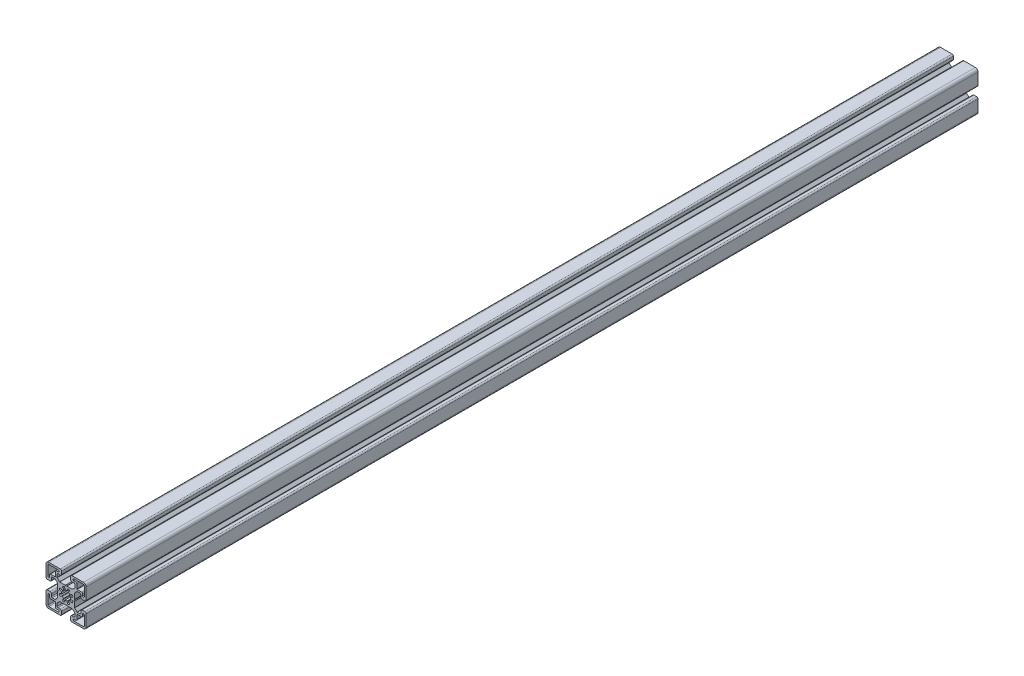
from build123d import *

# Parameters (mm, degrees)
EXTRUDE1_DEPTH = 1000


with BuildPart() as part:
    # Sketch1 → Extrude1 (new body)
    with BuildSketch(Plane.XY):
        with BuildLine():
            Line((2.070696762, -5.483119356), (2.970696689, -4.967971313))
            Line((2.970696689, -4.967971313), (3.870696615, -5.483119356))
            Line((3.870696615, -5.483119356), (10.022269564, -5.483119356))
            ThreePointArc((10.022269564, -5.483119356), (10.167689268, -5.512045134), (10.290970141, -5.59441878))
            Line((10.290970141, -5.59441878), (12.909397265, -8.212845904))
            ThreePointArc((12.909397265, -8.212845904), (12.991770911, -8.336126777), (13.020696689, -8.481546481))
            Line((13.020696689, -8.481546481), (13.020696689, -11.483119356))
            ThreePointArc((13.020696689, -11.483119356), (12.72780347, -12.190226138), (12.020696689, -12.483119356))
            Line((12.020696689, -12.483119356), (9.555696689, -12.483119356))
            ThreePointArc((9.555696689, -12.483119356), (8.480894381, -12.928317049), (8.035696689, -14.003119356))
            Line((8.035696689, -14.003119356), (8.035696689, -16.963119356))
            ThreePointArc((8.035696689, -16.963119356), (8.480894381, -18.037921664), (9.555696689, -18.483119356))
            Line((9.555696689, -18.483119356), (22.470696689, -18.483119356))
            ThreePointArc((22.470696689, -18.483119356), (24.592017032, -17.6044397), (25.470696689, -15.483119356))
            Line((25.470696689, -15.483119356), (25.470696689, -2.568119356))
            ThreePointArc((25.470696689, -2.568119356), (25.025498996, -1.493317049), (23.950696689, -1.048119356))
            Line((23.950696689, -1.048119356), (20.990696689, -1.048119356))
            ThreePointArc((20.990696689, -1.048119356), (19.915894381, -1.493317049), (19.470696689, -2.568119356))
            Line((19.470696689, -2.568119356), (19.470696689, -5.033119356))
            ThreePointArc((19.470696689, -5.033119356), (19.17780347, -5.740226138), (18.470696689, -6.033119356))
            Line((18.470696689, -6.033119356), (15.469123813, -6.033119356))
            ThreePointArc((15.469123813, -6.033119356), (15.323704109, -6.004193579), (15.200423236, -5.921819933))
            Line((15.200423236, -5.921819933), (12.581996112, -3.303392809))
            ThreePointArc((12.581996112, -3.303392809), (12.499622466, -3.180111936), (12.470696689, -3.034692232))
            Line((12.470696689, -3.034692232), (12.470696689, 3.116881008))
            Line((12.470696689, 3.116881008), (11.951083419, 4.016880644))
            Line((11.951083419, 4.016880644), (12.470696689, 4.916880279))
            Line((12.470696689, 4.916880279), (12.470696689, 11.068453519))
            ThreePointArc((12.470696689, 11.068453519), (12.499622466, 11.213873223), (12.581996112, 11.337154096))
            Line((12.581996112, 11.337154096), (15.200423236, 13.95558122))
            ThreePointArc((15.200423236, 13.95558122), (15.323704109, 14.037954866), (15.469123813, 14.066880644))
            Line((15.469123813, 14.066880644), (18.470696689, 14.066880644))
            ThreePointArc((18.470696689, 14.066880644), (19.17780347, 13.773987425), (19.470696689, 13.066880644))
            Line((19.470696689, 13.066880644), (19.470696689, 10.601880644))
            ThreePointArc((19.470696689, 10.601880644), (19.915894381, 9.527078336), (20.990696689, 9.081880644))
            Line((20.990696689, 9.081880644), (23.950696689, 9.081880644))
            ThreePointArc((23.950696689, 9.081880644), (25.025498996, 9.527078336), (25.470696689, 10.601880644))
            Line((25.470696689, 10.601880644), (25.470696689, 23.516880644))
            ThreePointArc((25.470696689, 23.516880644), (24.592017032, 25.638200987), (22.470696689, 26.516880644))
            Line((22.470696689, 26.516880644), (9.555696689, 26.516880644))
            ThreePointArc((9.555696689, 26.516880644), (8.480894381, 26.071682951), (8.035696689, 24.996880644))
            Line((8.035696689, 24.996880644), (8.035696689, 22.036880644))
            ThreePointArc((8.035696689, 22.036880644), (8.480894381, 20.962078336), (9.555696689, 20.516880644))
            Line((9.555696689, 20.516880644), (12.020696689, 20.516880644))
            ThreePointArc((12.020696689, 20.516880644), (12.72780347, 20.223987425), (13.020696689, 19.516880644))
            Line((13.020696689, 19.516880644), (13.020696689, 16.515307768))
            ThreePointArc((13.020696689, 16.515307768), (12.991770911, 16.369888064), (12.909397265, 16.246607191))
            Line((12.909397265, 16.246607191), (10.290970141, 13.628180067))
            ThreePointArc((10.290970141, 13.628180067), (10.167689268, 13.545806421), (10.022269564, 13.516880644))
            Line((10.022269564, 13.516880644), (3.870696615, 13.516880644))
            Line((3.870696615, 13.516880644), (2.970696689, 13.0017326))
            Line((2.970696689, 13.0017326), (2.070696762, 13.516880644))
            Line((2.070696762, 13.516880644), (-4.080876187, 13.516880644))
            ThreePointArc((-4.080876187, 13.516880644), (-4.226295891, 13.545806421), (-4.349576764, 13.628180067))
            Line((-4.349576764, 13.628180067), (-6.968003888, 16.246607191))
            ThreePointArc((-6.968003888, 16.246607191), (-7.050377534, 16.369888064), (-7.079303311, 16.515307768))
            Line((-7.079303311, 16.515307768), (-7.079303311, 19.516880644))
            ThreePointArc((-7.079303311, 19.516880644), (-6.786410093, 20.223987425), (-6.079303311, 20.516880644))
            Line((-6.079303311, 20.516880644), (-3.614303311, 20.516880644))
            ThreePointArc((-3.614303311, 20.516880644), (-2.539501004, 20.962078336), (-2.094303311, 22.036880644))
            Line((-2.094303311, 22.036880644), (-2.094303311, 24.996880644))
            ThreePointArc((-2.094303311, 24.996880644), (-2.539501004, 26.071682951), (-3.614303311, 26.516880644))
            Line((-3.614303311, 26.516880644), (-16.529303311, 26.516880644))
            ThreePointArc((-16.529303311, 26.516880644), (-18.650623655, 25.638200987), (-19.529303311, 23.516880644))
            Line((-19.529303311, 23.516880644), (-19.529303311, 10.601880644))
            ThreePointArc((-19.529303311, 10.601880644), (-19.084105619, 9.527078336), (-18.009303311, 9.081880644))
            Line((-18.009303311, 9.081880644), (-15.049303311, 9.081880644))
            ThreePointArc((-15.049303311, 9.081880644), (-13.974501004, 9.527078336), (-13.529303311, 10.601880644))
            Line((-13.529303311, 10.601880644), (-13.529303311, 13.066880644))
            ThreePointArc((-13.529303311, 13.066880644), (-13.236410093, 13.773987425), (-12.529303311, 14.066880644))
            Line((-12.529303311, 14.066880644), (-9.527730436, 14.066880644))
            ThreePointArc((-9.527730436, 14.066880644), (-9.382310732, 14.037954866), (-9.259029859, 13.95558122))
            Line((-9.259029859, 13.95558122), (-6.640602735, 11.337154096))
            ThreePointArc((-6.640602735, 11.337154096), (-6.558229089, 11.213873223), (-6.529303311, 11.068453519))
            Line((-6.529303311, 11.068453519), (-6.529303311, 4.916880279))
            Line((-6.529303311, 4.916880279), (-6.009690042, 4.016880644))
            Line((-6.009690042, 4.016880644), (-6.529303311, 3.116881008))
            Line((-6.529303311, 3.116881008), (-6.529303311, -3.034692232))
            ThreePointArc((-6.529303311, -3.034692232), (-6.558229089, -3.180111936), (-6.640602735, -3.303392809))
            Line((-6.640602735, -3.303392809), (-9.259029859, -5.921819933))
            ThreePointArc((-9.259029859, -5.921819933), (-9.382310732, -6.004193579), (-9.527730436, -6.033119356))
            Line((-9.527730436, -6.033119356), (-12.529303311, -6.033119356))
            ThreePointArc((-12.529303311, -6.033119356), (-13.236410093, -5.740226138), (-13.529303311, -5.033119356))
            Line((-13.529303311, -5.033119356), (-13.529303311, -2.568119356))
            ThreePointArc((-13.529303311, -2.568119356), (-13.974501004, -1.493317049), (-15.049303311, -1.048119356))
            Line((-15.049303311, -1.048119356), (-18.009303311, -1.048119356))
            ThreePointArc((-18.009303311, -1.048119356), (-19.084105619, -1.493317049), (-19.529303311, -2.568119356))
            Line((-19.529303311, -2.568119356), (-19.529303311, -15.483119356))
            ThreePointArc((-19.529303311, -15.483119356), (-18.650623655, -17.6044397), (-16.529303311, -18.483119356))
            Line((-16.529303311, -18.483119356), (-3.614303311, -18.483119356))
            ThreePointArc((-3.614303311, -18.483119356), (-2.539501004, -18.037921664), (-2.094303311, -16.963119356))
            Line((-2.094303311, -16.963119356), (-2.094303311, -14.003119356))
            ThreePointArc((-2.094303311, -14.003119356), (-2.539501004, -12.928317049), (-3.614303311, -12.483119356))
            Line((-3.614303311, -12.483119356), (-6.079303311, -12.483119356))
            ThreePointArc((-6.079303311, -12.483119356), (-6.786410093, -12.190226138), (-7.079303311, -11.483119356))
            Line((-7.079303311, -11.483119356), (-7.079303311, -8.481546481))
            ThreePointArc((-7.079303311, -8.481546481), (-7.050377534, -8.336126777), (-6.968003888, -8.212845904))
            Line((-6.968003888, -8.212845904), (-4.349576764, -5.59441878))
            ThreePointArc((-4.349576764, -5.59441878), (-4.226295891, -5.512045134), (-4.080876187, -5.483119356))
            Line((-4.080876187, -5.483119356), (2.070696762, -5.483119356))
        make_face()
        with BuildLine():
            Line((-8.029303311, -14.483119356), (-6.029303311, -14.483119356))
            ThreePointArc((-6.029303311, -14.483119356), (-5.029303311, -15.483119356), (-6.029303311, -16.483119356))
            Line((-6.029303311, -16.483119356), (-16.529303311, -16.483119356))
            ThreePointArc((-16.529303311, -16.483119356), (-17.236410093, -16.190226138), (-17.529303311, -15.483119356))
            Line((-17.529303311, -15.483119356), (-17.529303311, -4.983119356))
            ThreePointArc((-17.529303311, -4.983119356), (-16.529303311, -3.983119356), (-15.529303311, -4.983119356))
            Line((-15.529303311, -4.983119356), (-15.529303311, -6.983119356))
            ThreePointArc((-15.529303311, -6.983119356), (-15.236410093, -7.690226138), (-14.529303311, -7.983119356))
            Line((-14.529303311, -7.983119356), (-9.409303311, -7.983119356))
            ThreePointArc((-9.409303311, -7.983119356), (-9.140602735, -8.09441878), (-9.029303311, -8.363119356))
            Line((-9.029303311, -8.363119356), (-9.029303311, -13.483119356))
            ThreePointArc((-9.029303311, -13.483119356), (-8.736410093, -14.190226138), (-8.029303311, -14.483119356))
        make_face(mode=Mode.SUBTRACT)
        with BuildLine():
            Line((-15.529303311, 15.016880644), (-15.529303311, 13.016880644))
            ThreePointArc((-15.529303311, 13.016880644), (-16.529303311, 12.016880644), (-17.529303311, 13.016880644))
            Line((-17.529303311, 13.016880644), (-17.529303311, 23.516880644))
            ThreePointArc((-17.529303311, 23.516880644), (-17.236410093, 24.223987425), (-16.529303311, 24.516880644))
            Line((-16.529303311, 24.516880644), (-6.029303311, 24.516880644))
            ThreePointArc((-6.029303311, 24.516880644), (-5.029303311, 23.516880644), (-6.029303311, 22.516880644))
            Line((-6.029303311, 22.516880644), (-8.029303311, 22.516880644))
            ThreePointArc((-8.029303311, 22.516880644), (-8.736410093, 22.223987425), (-9.029303311, 21.516880644))
            Line((-9.029303311, 21.516880644), (-9.029303311, 16.396880644))
            ThreePointArc((-9.029303311, 16.396880644), (-9.140602735, 16.128180067), (-9.409303311, 16.016880644))
            Line((-9.409303311, 16.016880644), (-14.529303311, 16.016880644))
            ThreePointArc((-14.529303311, 16.016880644), (-15.236410093, 15.723987425), (-15.529303311, 15.016880644))
        make_face(mode=Mode.SUBTRACT)
        with BuildLine():
            Line((14.970696689, 16.396880644), (14.970696689, 21.516880644))
            ThreePointArc((14.970696689, 21.516880644), (14.67780347, 22.223987425), (13.970696689, 22.516880644))
            Line((13.970696689, 22.516880644), (11.970696689, 22.516880644))
            ThreePointArc((11.970696689, 22.516880644), (10.970696689, 23.516880644), (11.970696689, 24.516880644))
            Line((11.970696689, 24.516880644), (22.470696689, 24.516880644))
            ThreePointArc((22.470696689, 24.516880644), (23.17780347, 24.223987425), (23.470696689, 23.516880644))
            Line((23.470696689, 23.516880644), (23.470696689, 13.016880644))
            ThreePointArc((23.470696689, 13.016880644), (22.470696689, 12.016880644), (21.470696689, 13.016880644))
            Line((21.470696689, 13.016880644), (21.470696689, 15.016880644))
            ThreePointArc((21.470696689, 15.016880644), (21.17780347, 15.723987425), (20.470696689, 16.016880644))
            Line((20.470696689, 16.016880644), (15.350696689, 16.016880644))
            ThreePointArc((15.350696689, 16.016880644), (15.081996112, 16.128180067), (14.970696689, 16.396880644))
        make_face(mode=Mode.SUBTRACT)
        with BuildLine():
            Line((8.813667521, 0.293110828), (7.186693868, 1.328876219))
            ThreePointArc((7.186693868, 1.328876219), (6.506092102, 0.48120825), (5.658370816, -0.199327106))
            Line((5.658370816, -0.199327106), (6.694267562, -1.8260382))
            ThreePointArc((6.694267562, -1.8260382), (6.809058347, -2.648996527), (6.26221419, -3.274615262))
            ThreePointArc((6.26221419, -3.274615262), (6.032089534, -3.374186522), (5.798957452, -3.466497007))
            ThreePointArc((5.798957452, -3.466497007), (4.969968429, -3.410814072), (4.469198099, -2.747826542))
            Line((4.469198099, -2.747826542), (4.051150727, -0.864985708))
            ThreePointArc((4.051150727, -0.864985708), (2.970500834, -0.983119353), (1.889860199, -0.864901048))
            Line((1.889860199, -0.864901048), (1.472091367, -2.747649108))
            ThreePointArc((1.472091367, -2.747649108), (0.971341296, -3.410737864), (0.142284835, -3.466439902))
            ThreePointArc((0.142284835, -3.466439902), (-0.090845384, -3.37412471), (-0.32096803, -3.274548804))
            ThreePointArc((-0.32096803, -3.274548804), (-0.867778008, -2.648991264), (-0.753073127, -1.826090189))
            Line((-0.753073127, -1.826090189), (0.282692264, -0.199116535))
            ThreePointArc((0.282692264, -0.199116535), (-0.564975705, 0.48148523), (-1.245511061, 1.329206516))
            Line((-1.245511061, 1.329206516), (-2.872222155, 0.29330977))
            ThreePointArc((-2.872222155, 0.29330977), (-3.695180482, 0.178518985), (-4.320799217, 0.725363142))
            ThreePointArc((-4.320799217, 0.725363142), (-4.420370477, 0.955487798), (-4.512680962, 1.18861988))
            ThreePointArc((-4.512680962, 1.18861988), (-4.456998027, 2.017608903), (-3.794010497, 2.518379234))
            Line((-3.794010497, 2.518379234), (-1.911169663, 2.936426605))
            ThreePointArc((-1.911169663, 2.936426605), (-2.029303308, 4.017076498), (-1.911085003, 5.097717133))
            Line((-1.911085003, 5.097717133), (-3.793833063, 5.515485965))
            ThreePointArc((-3.793833063, 5.515485965), (-4.456921819, 6.016236036), (-4.512623857, 6.845292497))
            ThreePointArc((-4.512623857, 6.845292497), (-4.420308665, 7.078422716), (-4.320732759, 7.308545362))
            ThreePointArc((-4.320732759, 7.308545362), (-3.695175219, 7.85535534), (-2.872274144, 7.740650459))
            Line((-2.872274144, 7.740650459), (-1.24530049, 6.704885068))
            ThreePointArc((-1.24530049, 6.704885068), (-0.564698724, 7.552553037), (0.283022561, 8.233088393))
            Line((0.283022561, 8.233088393), (-0.752874185, 9.859799487))
            ThreePointArc((-0.752874185, 9.859799487), (-0.86766497, 10.682757814), (-0.320820813, 11.308376549))
            ThreePointArc((-0.320820813, 11.308376549), (-0.090696157, 11.407947809), (0.142435925, 11.500258294))
            ThreePointArc((0.142435925, 11.500258294), (0.971424948, 11.444575359), (1.472195279, 10.781587829))
            Line((1.472195279, 10.781587829), (1.89024265, 8.898746995))
            ThreePointArc((1.89024265, 8.898746995), (2.970892543, 9.01688064), (4.051533178, 8.898662335))
            Line((4.051533178, 8.898662335), (4.46930201, 10.781410395))
            ThreePointArc((4.46930201, 10.781410395), (4.970052081, 11.444499151), (5.799108542, 11.500201189))
            ThreePointArc((5.799108542, 11.500201189), (6.032238761, 11.407885997), (6.262361407, 11.308310091))
            ThreePointArc((6.262361407, 11.308310091), (6.809171385, 10.682752551), (6.694466504, 9.859851476))
            Line((6.694466504, 9.859851476), (5.658701113, 8.232877822))
            ThreePointArc((5.658701113, 8.232877822), (6.506369082, 7.552276057), (7.186904438, 6.704554771))
            Line((7.186904438, 6.704554771), (8.813615532, 7.740451517))
            ThreePointArc((8.813615532, 7.740451517), (9.636573859, 7.855242302), (10.262192594, 7.308398145))
            ThreePointArc((10.262192594, 7.308398145), (10.361763854, 7.078273489), (10.454074339, 6.845141407))
            ThreePointArc((10.454074339, 6.845141407), (10.398391404, 6.016152384), (9.735403874, 5.515382054))
            Line((9.735403874, 5.515382054), (7.85256304, 5.097334682))
            ThreePointArc((7.85256304, 5.097334682), (7.970696685, 4.016684789), (7.85247838, 2.936044154))
            Line((7.85247838, 2.936044154), (9.73522644, 2.518275322))
            ThreePointArc((9.73522644, 2.518275322), (10.398315196, 2.017525251), (10.454017234, 1.18846879))
            ThreePointArc((10.454017234, 1.18846879), (10.361702042, 0.955338571), (10.262126136, 0.725215925))
            ThreePointArc((10.262126136, 0.725215925), (9.636568596, 0.178405947), (8.813667521, 0.293110828))
        make_face(mode=Mode.SUBTRACT)
        with BuildLine():
            Line((21.470696689, -6.983119356), (21.470696689, -4.983119356))
            ThreePointArc((21.470696689, -4.983119356), (22.470696689, -3.983119356), (23.470696689, -4.983119356))
            Line((23.470696689, -4.983119356), (23.470696689, -15.483119356))
            ThreePointArc((23.470696689, -15.483119356), (23.17780347, -16.190226138), (22.470696689, -16.483119356))
            Line((22.470696689, -16.483119356), (11.970696689, -16.483119356))
            ThreePointArc((11.970696689, -16.483119356), (10.970696689, -15.483119356), (11.970696689, -14.483119356))
            Line((11.970696689, -14.483119356), (13.970696689, -14.483119356))
            ThreePointArc((13.970696689, -14.483119356), (14.67780347, -14.190226138), (14.970696689, -13.483119356))
            Line((14.970696689, -13.483119356), (14.970696689, -8.363119356))
            ThreePointArc((14.970696689, -8.363119356), (15.081996112, -8.09441878), (15.350696689, -7.983119356))
            Line((15.350696689, -7.983119356), (20.470696689, -7.983119356))
            ThreePointArc((20.470696689, -7.983119356), (21.17780347, -7.690226138), (21.470696689, -6.983119356))
        make_face(mode=Mode.SUBTRACT)
    extrude(amount=EXTRUDE1_DEPTH)


solid = part.part
